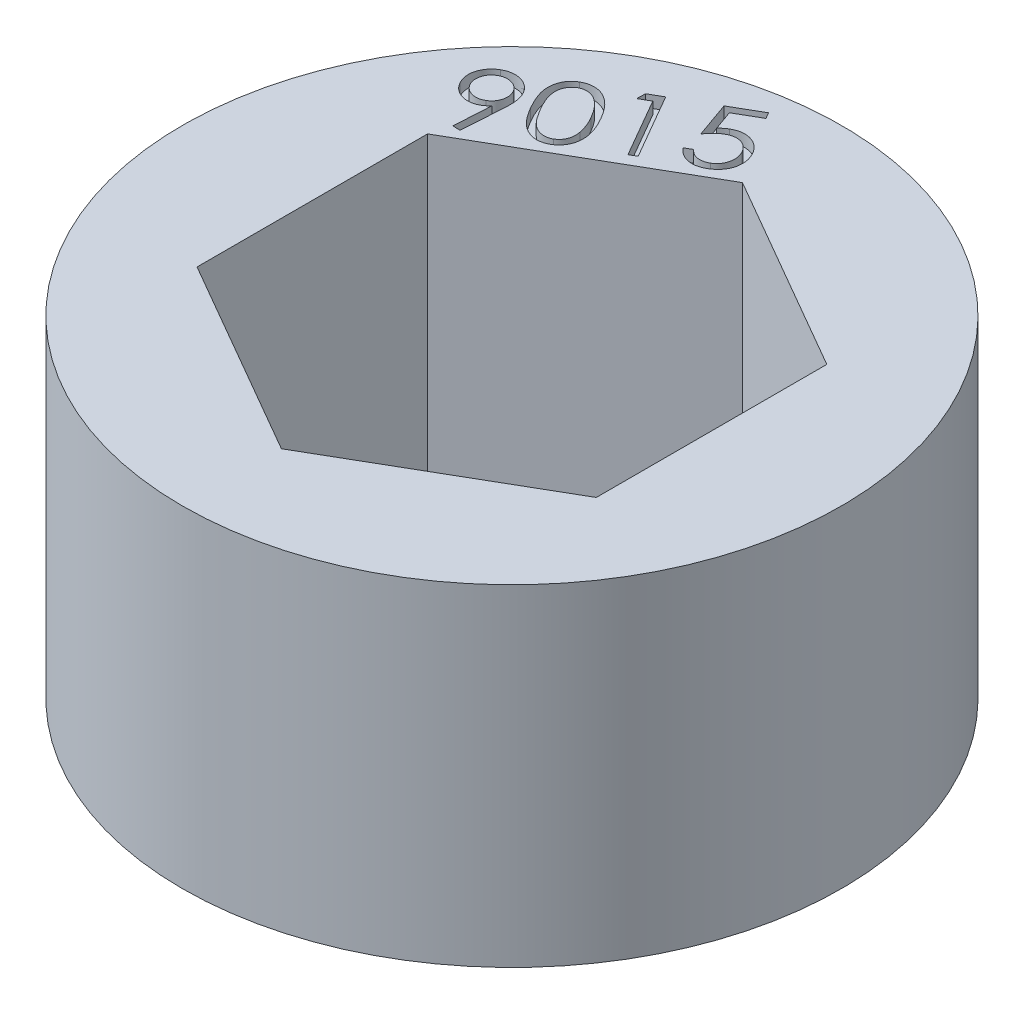
from build123d import *

# Parameters (mm, degrees)
SKETCH1_R           = 11.1125
BOSS_EXTRUDE1_DEPTH = 11.176
CUT_EXTRUDE1_DEPTH  = 0.4


with BuildPart() as part:
    # Sketch1 → Boss-Extrude1 (new body)
    with BuildSketch(Plane(origin=(0, 0, 0), x_dir=(1, 0, 0), z_dir=(0, 1, 0))):
        with Locations(Location((0, 0, 0), (0, 0, 270))):
            Circle(SKETCH1_R)
        Polygon((0, 7.772289324), (-6.731, 3.886144662), (-6.731, -3.886144662), (0, -7.772289324), (6.731, -3.886144662), (6.731, 3.886144662), align=None, mode=Mode.SUBTRACT)
    extrude(amount=BOSS_EXTRUDE1_DEPTH)

    # Sketch2 → Cut-Extrude1 (cut)
    # profile 1 of 4: a face of its own
    with BuildSketch(Plane(origin=(0, 11.176, 0), x_dir=(1, 0, 0), z_dir=(0, 1, 0))):
        with BuildLine():
            Line((-6.289733288, 4.536079133), (-6.537525756, 4.548290671))
            Line((-6.537525756, 4.548290671), (-6.464256525, 5.791323524))
            add(Edge.make_bspline(
                [(-6.464256525, 5.791323524), (-6.480242541, 5.773894572), (-6.511338885, 5.739991398), (-6.561839603, 5.69527463), (-6.612409982, 5.655457776), (-6.648221968, 5.633601591), (-6.66574691, 5.622906056)],
                knots=[0, 0, 0, 0, 1.07557127, 2.092224476, 3.066411598, 4, 4, 4, 4], degree=3))
            add(Edge.make_bspline(
                [(-6.66574691, 5.622906056), (-6.687405443, 5.611087473), (-6.730257805, 5.587703887), (-6.797554319, 5.560988642), (-6.865684027, 5.541202356), (-6.93486375, 5.529817864), (-7.004705016, 5.524358865), (-7.075685789, 5.527087617), (-7.147393014, 5.537446994), (-7.219246238, 5.554721004), (-7.289510388, 5.578337576), (-7.35650875, 5.608467922), (-7.419450569, 5.644728708), (-7.478082535, 5.687225822), (-7.532917297, 5.735292443), (-7.583437177, 5.789428113), (-7.629542025, 5.849943619), (-7.656438539, 5.893688865), (-7.670145948, 5.915982979)],
                knots=[0, 0, 0, 0, 1.015135184, 2.008489705, 2.974464217, 3.930823522, 4.890110555, 5.854468119, 6.84900024, 7.868689235, 8.893387844, 9.896732215, 10.888539014, 11.878968029, 12.873598221, 13.886496971, 14.922884625, 16, 16, 16, 16], degree=3))
            add(Edge.make_bspline(
                [(-7.670145948, 5.915982979), (-7.686989422, 5.947462864), (-7.72012857, 6.009398813), (-7.753683399, 6.108003656), (-7.77554064, 6.207694842), (-7.781550764, 6.308794459), (-7.775514984, 6.409686012), (-7.754046851, 6.508718862), (-7.719584706, 6.605382614), (-7.671907384, 6.698347933), (-7.612573873, 6.785344663), (-7.543839337, 6.864438697), (-7.464533964, 6.933174876), (-7.405410215, 6.970311538), (-7.375542583, 6.989071921)],
                knots=[0, 0, 0, 0, 1.035324533, 2.036977218, 3.013660684, 3.991039457, 4.968418229, 5.940283026, 6.923354643, 7.941094773, 8.965736768, 9.974485588, 10.976767849, 12, 12, 12, 12], degree=3))
            add(Edge.make_bspline(
                [(-7.375542583, 6.989071921), (-7.34507095, 7.005375839), (-7.284810938, 7.037618098), (-7.188138027, 7.070437121), (-7.088780159, 7.090561187), (-6.987526986, 7.097552892), (-6.886165863, 7.091769651), (-6.78725838, 7.071601586), (-6.691339738, 7.038343454), (-6.60068211, 6.990771666), (-6.515764574, 6.933108074), (-6.439404084, 6.865662075), (-6.372846225, 6.788703753), (-6.336853355, 6.731436227), (-6.318735692, 6.702609581)],
                knots=[0, 0, 0, 0, 1.019400264, 2.015942902, 3.002372847, 4.006779929, 5.005536382, 5.991966327, 6.979044859, 7.994053264, 9.007032045, 10.004279611, 10.995418019, 12, 12, 12, 12], degree=3))
            add(Edge.make_bspline(
                [(-6.318735692, 6.702609581), (-6.306240701, 6.679251996), (-6.280812696, 6.631718005), (-6.25054166, 6.554911705), (-6.226293373, 6.472609431), (-6.210571268, 6.400087646), (-6.201314114, 6.338420317), (-6.195489764, 6.288208021), (-6.192449763, 6.234523461), (-6.189498973, 6.177377331), (-6.1893075, 6.116958119), (-6.190314512, 6.053006011), (-6.19282965, 5.985653618), (-6.195674596, 5.939552777), (-6.197129121, 5.915982979)],
                knots=[0, 0, 0, 0, 1.179517641, 2.400384276, 3.669978525, 4.99951221, 5.702757638, 6.447991837, 7.250775919, 8.098000084, 8.997311831, 9.942054579, 10.947842213, 12, 12, 12, 12], degree=3))
            Line((-6.197129121, 5.915982979), (-6.289733288, 4.536079133))
        make_face()
        with BuildLine():
            add(Edge.make_bspline(
                [(-6.726295788, 5.844749004), (-6.71064732, 5.854271721), (-6.67991488, 5.872973636), (-6.638085098, 5.906050151), (-6.59996958, 5.941564352), (-6.566919829, 5.981135696), (-6.537714626, 6.023521997), (-6.512770228, 6.069073108), (-6.491586076, 6.117668987), (-6.475865153, 6.169141379), (-6.463817651, 6.221644628), (-6.458056762, 6.274374402), (-6.456118693, 6.326312762), (-6.460240047, 6.377704907), (-6.470203983, 6.428038328), (-6.484352589, 6.47793469), (-6.504337626, 6.526979386), (-6.521287063, 6.558422458), (-6.529893544, 6.574388428)],
                knots=[0, 0, 0, 0, 1.045108442, 2.052516081, 3.039037663, 4.014948609, 4.990090363, 5.974041511, 6.976128051, 8.011453109, 9.043011603, 10.047295345, 11.035574291, 12.007150616, 12.98344593, 13.961229243, 14.964765542, 16, 16, 16, 16], degree=3))
            add(Edge.make_bspline(
                [(-6.529893544, 6.574388428), (-6.539249183, 6.589862662), (-6.557739817, 6.620446186), (-6.590521987, 6.662080801), (-6.626381741, 6.699690397), (-6.665743743, 6.732780086), (-6.708181599, 6.761903737), (-6.753581699, 6.787026304), (-6.802439709, 6.807412214), (-6.853751361, 6.823401486), (-6.906330508, 6.835095), (-6.95895449, 6.841964713), (-7.010975356, 6.842867475), (-7.062261796, 6.838767193), (-7.11298991, 6.829718382), (-7.162946419, 6.81457088), (-7.212656065, 6.795071434), (-7.244107621, 6.777604573), (-7.260041781, 6.768755415)],
                knots=[0, 0, 0, 0, 1.031712043, 2.039092063, 3.018573684, 3.994457873, 4.969572892, 5.953497063, 6.951758218, 7.98705489, 9.018585102, 10.024008046, 11.012022604, 11.983572292, 12.958061913, 13.947831088, 14.960318852, 16, 16, 16, 16], degree=3))
            add(Edge.make_bspline(
                [(-7.260041781, 6.768755415), (-7.275548329, 6.759439004), (-7.306081237, 6.741094681), (-7.34725729, 6.707776179), (-7.385379905, 6.672479408), (-7.418356414, 6.632849856), (-7.447704876, 6.590638681), (-7.471928382, 6.544786242), (-7.493265763, 6.496366511), (-7.508934864, 6.444865827), (-7.520996677, 6.392370164), (-7.526733977, 6.339807253), (-7.528690189, 6.288040119), (-7.524568034, 6.236817067), (-7.514607962, 6.186483739), (-7.500458314, 6.136587351), (-7.48047356, 6.087542663), (-7.463524083, 6.05609959), (-7.454917583, 6.04013362)],
                knots=[0, 0, 0, 0, 1.034021631, 2.036022986, 3.024725885, 4.002794686, 4.980092595, 5.961574923, 6.965877195, 8.00349148, 9.037330872, 10.043835206, 11.024597356, 11.998321951, 12.97677597, 13.956721278, 14.962476515, 16, 16, 16, 16], degree=3))
            add(Edge.make_bspline(
                [(-7.454917583, 6.04013362), (-7.445562349, 6.024658768), (-7.427072518, 5.994074025), (-7.394284497, 5.95244831), (-7.358446249, 5.914806002), (-7.319111883, 5.881927029), (-7.277096804, 5.852416955), (-7.231595382, 5.827649353), (-7.183019633, 5.806434909), (-7.131541644, 5.790722408), (-7.079039897, 5.778672645), (-7.026309733, 5.772912344), (-6.974371474, 5.770974121), (-6.922979303, 5.775095516), (-6.872645889, 5.785059441), (-6.822749524, 5.79920805), (-6.77370483, 5.819193086), (-6.742261757, 5.836142524), (-6.726295788, 5.844749004)],
                knots=[0, 0, 0, 0, 1.033571637, 2.042767394, 3.024014467, 4.001657624, 4.970548117, 5.956245748, 6.96011096, 7.997273687, 9.030663166, 10.03672948, 11.026762591, 12.000063433, 12.97809164, 13.957610489, 14.962928033, 16, 16, 16, 16], degree=3))
        make_face(mode=Mode.SUBTRACT)
    # profile 2 of 4: a face of its own
    with BuildSketch(Plane(origin=(0, 11.176, 0), x_dir=(1, 0, 0), z_dir=(0, 1, 0))):
        with BuildLine():
            add(Edge.make_bspline(
                [(-5.754187339, 6.384091953), (-5.774293485, 6.419396325), (-5.813397002, 6.488058169), (-5.866034024, 6.590465673), (-5.91315215, 6.687996963), (-5.953449969, 6.781164397), (-5.987295398, 6.86972097), (-6.014264868, 6.953849745), (-6.035638255, 7.033380296), (-6.049888486, 7.109113956), (-6.058619809, 7.181548399), (-6.062601698, 7.251221126), (-6.062856211, 7.318691765), (-6.058271229, 7.383994619), (-6.049205939, 7.447116612), (-6.035432829, 7.50803618), (-6.016976099, 7.566647617), (-5.994620362, 7.623140357), (-5.968452651, 7.677139167), (-5.937349294, 7.727501238), (-5.904178107, 7.775608715), (-5.866621008, 7.819808262), (-5.826373044, 7.861568139), (-5.781909405, 7.899391142), (-5.73455379, 7.934984377), (-5.700608239, 7.955588006), (-5.683462178, 7.965994998)],
                knots=[0, 0, 0, 0, 1.642217524, 3.193873097, 4.653599743, 6.020219012, 7.296149585, 8.484364078, 9.590266645, 10.622995624, 11.596731579, 12.537641419, 13.442669779, 14.322439731, 15.181528583, 16.018162769, 16.844365298, 17.663022962, 18.472528165, 19.266229043, 20.053716379, 20.832379209, 21.608138827, 22.395685855, 23.18965321, 24, 24, 24, 24], degree=3))
            add(Edge.make_bspline(
                [(-5.683462178, 7.965994998), (-5.66563454, 7.975796724), (-5.630291488, 7.995228513), (-5.574947636, 8.018860372), (-5.51920601, 8.039024632), (-5.462120844, 8.053805918), (-5.404262578, 8.063929555), (-5.345231728, 8.06958247), (-5.285348145, 8.070558879), (-5.224644164, 8.066897508), (-5.163312434, 8.058955872), (-5.101899155, 8.04511862), (-5.040677301, 8.025933176), (-4.979105772, 8.002804322), (-4.918424308, 7.972905924), (-4.857473214, 7.938551421), (-4.796343719, 7.899560349), (-4.735768702, 7.85435269), (-4.674503653, 7.803725452), (-4.613882954, 7.745708582), (-4.552994497, 7.680722999), (-4.492751705, 7.608524687), (-4.432696679, 7.529143413), (-4.371922586, 7.443276561), (-4.312209796, 7.349568109), (-4.273517599, 7.284128721), (-4.25369455, 7.25060237)],
                knots=[0, 0, 0, 0, 0.815881076, 1.617473213, 2.411751612, 3.192532544, 3.980223438, 4.766442947, 5.569622482, 6.380892254, 7.204795063, 8.048528362, 8.903143009, 9.777765604, 10.684831081, 11.614241792, 12.584586996, 13.591843045, 14.645331516, 15.771781295, 16.956234458, 18.217113798, 19.542884518, 20.949560407, 22.437178076, 24, 24, 24, 24], degree=3))
            add(Edge.make_bspline(
                [(-4.25369455, 7.25060237), (-4.234690702, 7.216780141), (-4.197627599, 7.150816829), (-4.146394818, 7.052709669), (-4.102388393, 6.957606704), (-4.06375745, 6.866288593), (-4.031813147, 6.778445302), (-4.005466056, 6.694139945), (-3.985556454, 6.61326208), (-3.971553551, 6.535580237), (-3.963763238, 6.460736031), (-3.959131325, 6.388727981), (-3.960560527, 6.319048982), (-3.965139736, 6.251653327), (-3.975651576, 6.18660532), (-3.989666869, 6.12376281), (-4.00853456, 6.063498422), (-4.03210177, 6.005932814), (-4.059343758, 5.951068478), (-4.090834897, 5.899529072), (-4.124644903, 5.8505242), (-4.162412934, 5.804855912), (-4.204607514, 5.763339639), (-4.249147626, 5.724032156), (-4.29735414, 5.687907222), (-4.331863462, 5.667054984), (-4.349351601, 5.656487787)],
                knots=[0, 0, 0, 0, 1.558572261, 3.039675171, 4.44500239, 5.767404933, 7.021920233, 8.19867626, 9.314183841, 10.366093107, 11.366862767, 12.335955634, 13.262731656, 14.164729598, 15.047477431, 15.907015182, 16.749641984, 17.580952634, 18.403702246, 19.207672054, 20.005351578, 20.794016824, 21.584181799, 22.380929523, 23.179510693, 24, 24, 24, 24], degree=3))
            add(Edge.make_bspline(
                [(-4.349351601, 5.656487787), (-4.366867865, 5.64692339), (-4.401647998, 5.627932412), (-4.455584616, 5.603818321), (-4.510920625, 5.585238922), (-4.566725332, 5.570088564), (-4.623682967, 5.560729828), (-4.681299048, 5.554891765), (-4.739996656, 5.554035612), (-4.799414032, 5.557375365), (-4.85905512, 5.566369161), (-4.918799441, 5.57920757), (-4.977922207, 5.59860306), (-5.037209801, 5.62190041), (-5.096304517, 5.650629538), (-5.155360864, 5.684164046), (-5.213955415, 5.723209146), (-5.272992568, 5.767022214), (-5.331645932, 5.817869105), (-5.390967307, 5.875768126), (-5.450819129, 5.941295459), (-5.510755803, 6.014932478), (-5.571475243, 6.095992393), (-5.632081705, 6.18508862), (-5.694078792, 6.281394124), (-5.73374727, 6.349169287), (-5.754187339, 6.384091953)],
                knots=[0, 0, 0, 0, 0.807491903, 1.603348545, 2.386916451, 3.167713854, 3.940658363, 4.719915701, 5.50935356, 6.313835313, 7.125313705, 7.947948844, 8.783651521, 9.640150085, 10.524255013, 11.440287308, 12.386399569, 13.372019105, 14.413529699, 15.525036669, 16.724996316, 18.002813491, 19.365932914, 20.822335035, 22.362637201, 24, 24, 24, 24], degree=3))
        make_face()
        with BuildLine():
            add(Edge.make_bspline(
                [(-5.544047114, 6.499592754), (-5.52658648, 6.469635353), (-5.492775062, 6.411624732), (-5.440722732, 6.329066845), (-5.389839812, 6.253328925), (-5.340729323, 6.183943981), (-5.292471574, 6.121691943), (-5.245019097, 6.066724801), (-5.19931687, 6.018007096), (-5.154224806, 5.975903967), (-5.109396023, 5.939358119), (-5.064587362, 5.907144081), (-5.019309127, 5.879194874), (-4.973966892, 5.855112011), (-4.928194317, 5.83512142), (-4.882233088, 5.818639915), (-4.835611692, 5.807159403), (-4.77455364, 5.796223916), (-4.699575679, 5.792036903), (-4.612937682, 5.800692291), (-4.530948212, 5.822078626), (-4.48143415, 5.847380164), (-4.456711377, 5.860013428)],
                knots=[0, 0, 0, 0, 1.475228016, 2.856686104, 4.15161897, 5.357081144, 6.47289893, 7.501387829, 8.445726694, 9.313720896, 10.124066195, 10.905058304, 11.660046733, 12.386348828, 13.08755313, 13.783651734, 14.460982071, 15.127735434, 16.421461315, 17.639985157, 18.821625413, 20, 20, 20, 20], degree=3))
            add(Edge.make_bspline(
                [(-4.456711377, 5.860013428), (-4.433210095, 5.875167649), (-4.386473482, 5.9053046), (-4.326638516, 5.965035038), (-4.276632416, 6.034934937), (-4.243199965, 6.100713561), (-4.222574331, 6.157822271), (-4.209542229, 6.203111769), (-4.201188418, 6.250698833), (-4.195874372, 6.300006821), (-4.195320308, 6.351206826), (-4.197055498, 6.404249124), (-4.203301327, 6.459144995), (-4.210059059, 6.496066769), (-4.213498236, 6.514857178)],
                knots=[0, 0, 0, 0, 1.342886321, 2.670576022, 4.038999414, 5.466462105, 6.205051725, 6.959707281, 7.731476591, 8.527516338, 9.344012544, 10.193626534, 11.080691652, 12, 12, 12, 12], degree=3))
            add(Edge.make_bspline(
                [(-4.213498236, 6.514857178), (-4.218301514, 6.538668619), (-4.228077303, 6.587130449), (-4.248401628, 6.659833425), (-4.272291032, 6.734422811), (-4.300675086, 6.810310901), (-4.333671229, 6.887532526), (-4.370173502, 6.96642732), (-4.411392775, 7.046902943), (-4.441751638, 7.100275027), (-4.457220191, 7.127469357)],
                knots=[0, 0, 0, 0, 0.879876913, 1.790754508, 2.73331625, 3.717259664, 4.725112015, 5.77538776, 6.866507818, 8, 8, 8, 8], degree=3))
            add(Edge.make_bspline(
                [(-4.457220191, 7.127469357), (-4.472953671, 7.154395208), (-4.503737596, 7.207077984), (-4.552331457, 7.282057596), (-4.599972981, 7.352681972), (-4.648293775, 7.417929235), (-4.697195744, 7.477724842), (-4.74544551, 7.533155772), (-4.794324147, 7.582970878), (-4.843281593, 7.627936761), (-4.892124645, 7.668061204), (-4.940291843, 7.703932752), (-4.988581279, 7.734565983), (-5.036316348, 7.761295466), (-5.084043059, 7.783023825), (-5.1312272, 7.800691115), (-5.178230646, 7.813537496), (-5.23948708, 7.823980223), (-5.314019222, 7.828278585), (-5.400084024, 7.820429936), (-5.481280875, 7.79884349), (-5.530335434, 7.773871359), (-5.55473221, 7.761451729)],
                knots=[0, 0, 0, 0, 1.327522451, 2.597413504, 3.803087542, 4.954092809, 6.052504639, 7.091116491, 8.08170511, 9.022070092, 9.919800897, 10.771882377, 11.577119672, 12.352806521, 13.099205072, 13.807429758, 14.495830891, 15.170113202, 16.450227669, 17.661618134, 18.837030004, 20, 20, 20, 20], degree=3))
            add(Edge.make_bspline(
                [(-5.55473221, 7.761451729), (-5.578268129, 7.746329038), (-5.625174133, 7.716190211), (-5.6847186, 7.655701744), (-5.735752136, 7.585407529), (-5.768763344, 7.518362712), (-5.790724395, 7.460792436), (-5.802511098, 7.414776676), (-5.811895219, 7.367255497), (-5.81760498, 7.317740822), (-5.818656653, 7.266377086), (-5.817555344, 7.213317018), (-5.811372707, 7.158684881), (-5.803026021, 7.101656467), (-5.789498074, 7.041447844), (-5.770476408, 6.977263975), (-5.74575291, 6.908653392), (-5.716252643, 6.835242841), (-5.681006683, 6.75763465), (-5.640521598, 6.675395672), (-5.594987317, 6.588537417), (-5.561372529, 6.529843972), (-5.544047114, 6.499592754)],
                knots=[0, 0, 0, 0, 1.186584607, 2.364808541, 3.584028067, 4.867913378, 5.52979883, 6.201670858, 6.884946004, 7.589109066, 8.317961587, 9.068444384, 9.84432244, 10.65432116, 11.518850237, 12.466086659, 13.499587148, 14.619373863, 15.830028341, 17.123623296, 18.517485242, 20, 20, 20, 20], degree=3))
        make_face(mode=Mode.SUBTRACT)
    # profile 3 of 4: a face of its own
    with BuildSketch(Plane(origin=(0, 11.176, 0), x_dir=(1, 0, 0), z_dir=(0, 1, 0))):
        Polygon((-4.228489146, 8.732269037), (-3.796505973, 8.981587947), (-2.526505973, 6.78300221), (-2.744787223, 6.656816312), (-3.890127768, 8.640173684), (-4.235103729, 8.44122737), align=None)
    # profile 4 of 4: a face of its own
    with BuildSketch(Plane(origin=(0, 11.176, 0), x_dir=(1, 0, 0), z_dir=(0, 1, 0))):
        with BuildLine():
            Line((-1.597646722, 10.251079133), (-1.476548966, 10.041956537))
            Line((-1.476548966, 10.041956537), (-2.25961387, 9.590129613))
            Line((-2.25961387, 9.590129613), (-2.023015312, 8.927144838))
            add(Edge.make_bspline(
                [(-2.023015312, 8.927144838), (-2.003378583, 8.946863747), (-1.965252777, 8.985149109), (-1.906541924, 9.03717757), (-1.847686633, 9.081409206), (-1.807462102, 9.106354342), (-1.787943197, 9.11845894)],
                knots=[0, 0, 0, 0, 1.098290535, 2.132392437, 3.093745641, 4, 4, 4, 4], degree=3))
            add(Edge.make_bspline(
                [(-1.787943197, 9.11845894), (-1.763074323, 9.131991624), (-1.714343382, 9.158509127), (-1.638455506, 9.189607276), (-1.562327813, 9.212771496), (-1.485589671, 9.227658817), (-1.408508592, 9.234258093), (-1.331029828, 9.232915764), (-1.253534497, 9.222306012), (-1.176317541, 9.204630506), (-1.10091416, 9.179399754), (-1.028766786, 9.146701779), (-0.960732482, 9.106785332), (-0.896796158, 9.059708712), (-0.837214966, 9.005432586), (-0.78130338, 8.944478968), (-0.729870701, 8.876181215), (-0.699688159, 8.826669136), (-0.684325408, 8.801467754)],
                knots=[0, 0, 0, 0, 1.055226793, 2.0677331, 3.052212554, 4.018542703, 4.977162288, 5.932437355, 6.902135778, 7.888705833, 8.882789797, 9.862196838, 10.837428505, 11.819120356, 12.817701552, 13.838412957, 14.899763852, 16, 16, 16, 16], degree=3))
            add(Edge.make_bspline(
                [(-0.684325408, 8.801467754), (-0.674218726, 8.783458625), (-0.654153825, 8.747704915), (-0.629027624, 8.692035725), (-0.607026672, 8.636021754), (-0.588578212, 8.579510897), (-0.574195373, 8.522230839), (-0.56420205, 8.464203352), (-0.557486595, 8.405421094), (-0.554560761, 8.346288976), (-0.554807116, 8.287470848), (-0.559627566, 8.229706634), (-0.567499316, 8.173197762), (-0.579877154, 8.118158057), (-0.595769306, 8.064479521), (-0.614923824, 8.011950923), (-0.638529207, 7.961064899), (-0.665552696, 7.91160292), (-0.696001063, 7.863716765), (-0.730277545, 7.81803249), (-0.767283568, 7.773996442), (-0.808474366, 7.732716438), (-0.852638257, 7.693136706), (-0.899973833, 7.655255986), (-0.951222258, 7.620112976), (-0.987127702, 7.598452536), (-1.005387107, 7.587437306)],
                knots=[0, 0, 0, 0, 1.056118218, 2.096722398, 3.121577719, 4.134163306, 5.135945977, 6.140280965, 7.144540977, 8.161134175, 9.167753235, 10.151407743, 11.12455722, 12.084580427, 13.03459039, 13.987251861, 14.942399827, 15.901559881, 16.869239022, 17.84285264, 18.821711144, 19.809604986, 20.823528204, 21.854828758, 22.909091632, 24, 24, 24, 24], degree=3))
            add(Edge.make_bspline(
                [(-1.005387107, 7.587437306), (-1.027610571, 7.57541529), (-1.071286824, 7.551788164), (-1.138780737, 7.522280631), (-1.2070023, 7.500881686), (-1.275235496, 7.484375888), (-1.344019875, 7.475954548), (-1.413151508, 7.474047794), (-1.482710475, 7.477837274), (-1.551970905, 7.489284495), (-1.619934349, 7.506387859), (-1.685413133, 7.529552357), (-1.748285808, 7.557675996), (-1.807414712, 7.593169229), (-1.864849513, 7.632314214), (-1.918199884, 7.678892029), (-1.96949989, 7.730063733), (-2.000282408, 7.768108916), (-2.015891915, 7.787401248)],
                knots=[0, 0, 0, 0, 1.072134106, 2.107088345, 3.120082218, 4.103094204, 5.082515459, 6.054688821, 7.035326059, 8.034103215, 9.029216361, 10.005856331, 10.978669035, 11.946542555, 12.928974578, 13.924426104, 14.947497235, 16, 16, 16, 16], degree=3))
            Line((-2.015891915, 7.787401248), (-1.790487267, 7.917657658))
            add(Edge.make_bspline(
                [(-1.790487267, 7.917657658), (-1.774237956, 7.899976056), (-1.742911723, 7.865888579), (-1.691526392, 7.82267935), (-1.64002224, 7.786613696), (-1.586379211, 7.760030869), (-1.531008462, 7.740668023), (-1.473090307, 7.729414096), (-1.412564919, 7.723449855), (-1.349953843, 7.725423677), (-1.286901527, 7.733077706), (-1.225539475, 7.748666959), (-1.166339129, 7.770419366), (-1.129331505, 7.79017954), (-1.110711626, 7.800121601)],
                knots=[0, 0, 0, 0, 1.147520606, 2.21224761, 3.204571573, 4.147865415, 5.066343476, 6.001860765, 6.963294874, 7.969548374, 8.991893607, 9.995363551, 10.991394674, 12, 12, 12, 12], degree=3))
            add(Edge.make_bspline(
                [(-1.110711626, 7.800121601), (-1.09313295, 7.810740202), (-1.058394554, 7.83172433), (-1.011749287, 7.869872714), (-0.969500801, 7.911309928), (-0.932264656, 7.95692982), (-0.899358756, 8.006274112), (-0.872512157, 8.060331384), (-0.850072004, 8.118073369), (-0.832424438, 8.179180188), (-0.82017882, 8.242161932), (-0.814468158, 8.305763856), (-0.81560702, 8.369009753), (-0.822824554, 8.43203331), (-0.836013215, 8.494986421), (-0.856182432, 8.557528857), (-0.881916215, 8.620100397), (-0.904062461, 8.660049922), (-0.915327011, 8.680369998)],
                knots=[0, 0, 0, 0, 0.980403286, 1.937440499, 2.871723006, 3.804773995, 4.746760611, 5.700152217, 6.68309888, 7.704111624, 8.735847065, 9.744916973, 10.7501705, 11.753624989, 12.7726731, 13.818607765, 14.890448496, 16, 16, 16, 16], degree=3))
            add(Edge.make_bspline(
                [(-0.915327011, 8.680369998), (-0.926239516, 8.698191573), (-0.947588424, 8.733057184), (-0.983860983, 8.781412605), (-1.02371831, 8.823853872), (-1.065596456, 8.862328864), (-1.111106317, 8.894656998), (-1.159090212, 8.922648254), (-1.210561589, 8.944332931), (-1.264128036, 8.961635719), (-1.319500997, 8.973603225), (-1.375699028, 8.978357277), (-1.432298776, 8.978035079), (-1.489264228, 8.971314855), (-1.546706048, 8.958461634), (-1.604245745, 8.939230768), (-1.662791949, 8.91507009), (-1.700451457, 8.89412621), (-1.719762107, 8.883386825)],
                knots=[0, 0, 0, 0, 1.07318392, 2.099545848, 3.098281199, 4.060630323, 5.015734557, 5.96024906, 6.908653524, 7.87854567, 8.849141968, 9.811491091, 10.769927648, 11.75230143, 12.752138279, 13.788107204, 14.865808624, 16, 16, 16, 16], degree=3))
            add(Edge.make_bspline(
                [(-1.719762107, 8.883386825), (-1.736212015, 8.873464524), (-1.770129036, 8.853006362), (-1.819022172, 8.816544045), (-1.868823988, 8.775509035), (-1.919009672, 8.729380257), (-1.96931639, 8.677501531), (-2.020925803, 8.621270357), (-2.071984499, 8.559023788), (-2.105559686, 8.515434592), (-2.122742876, 8.493126408)],
                knots=[0, 0, 0, 0, 0.816257212, 1.682988962, 2.589562383, 3.559120875, 4.578856269, 5.660923536, 6.802901792, 8, 8, 8, 8], degree=3))
            Line((-2.122742876, 8.493126408), (-2.549637908, 9.701559902))
            Line((-2.549637908, 9.701559902), (-1.597646722, 10.251079133))
        make_face()
    extrude(amount=-CUT_EXTRUDE1_DEPTH, mode=Mode.SUBTRACT)


solid = part.part
